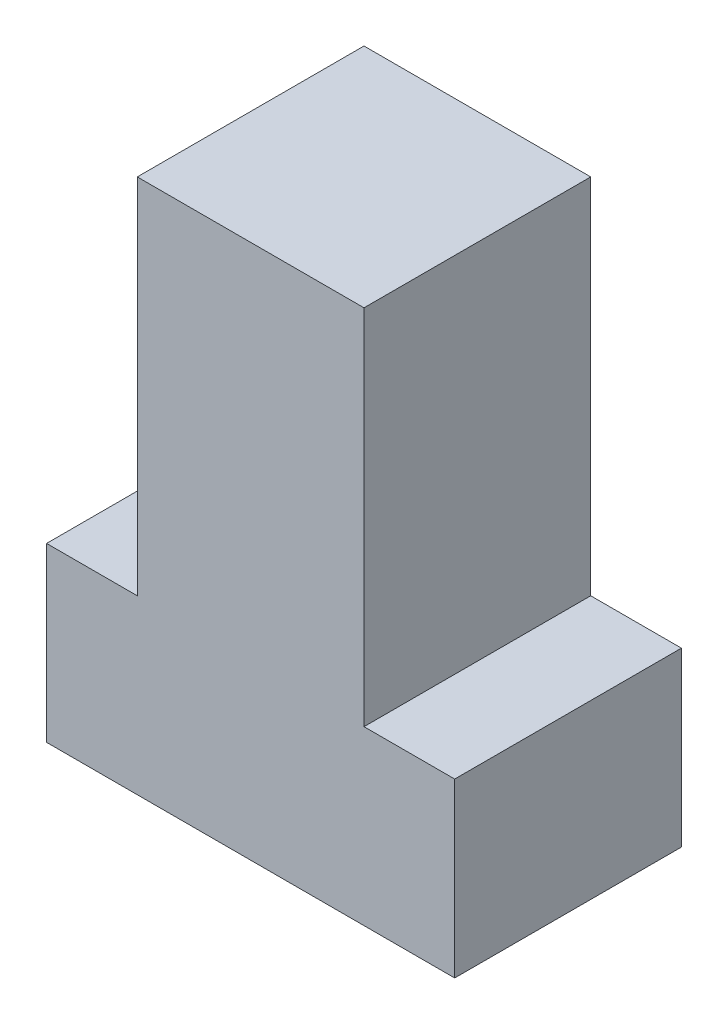
from build123d import *

# Parameters (mm, degrees)
BOSS_EXTRUDE1_DEPTH = 5


with BuildPart() as part:
    # Sketch2 → Boss-Extrude1 (new body)
    with BuildSketch(Plane.XY):
        Polygon((38.991050293, -6.619940905), (47.991050293, -6.619940905), (47.991050293, -2.819940905), (45.991050293, -2.819940905), (45.991050293, 5.180059095), (40.991050293, 5.180059095), (40.991050293, -2.819940905), (38.991050293, -2.819940905), align=None)
    extrude(amount=BOSS_EXTRUDE1_DEPTH)


solid = part.part
